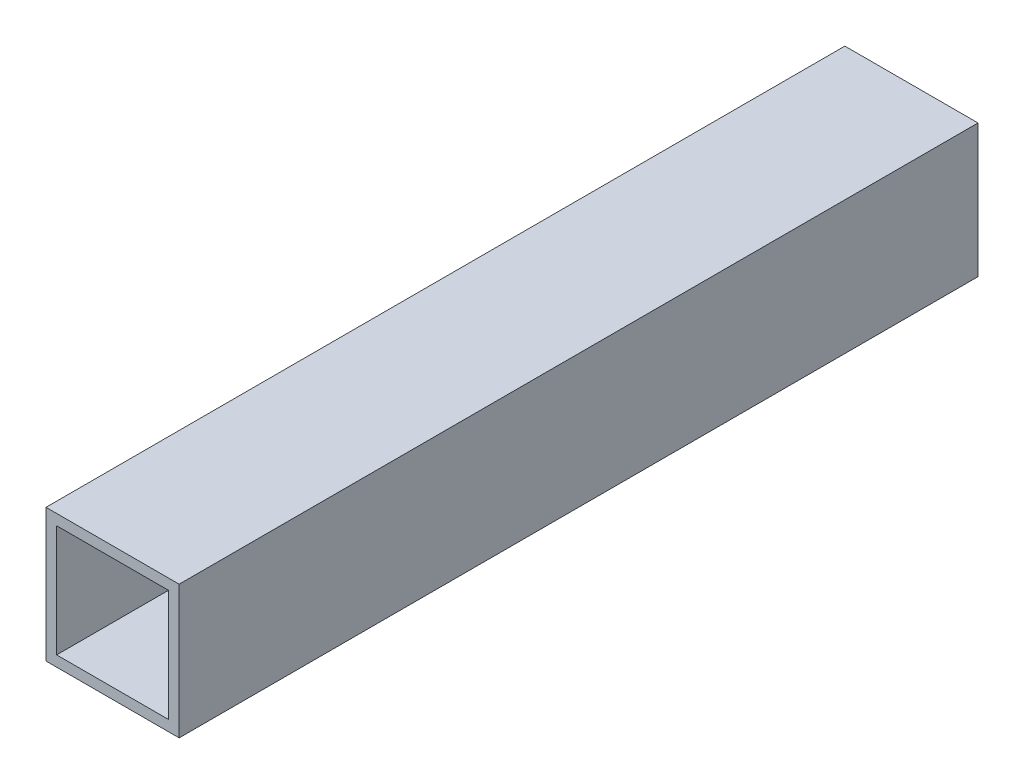
from build123d import *

# Parameters (mm, degrees)
SKIZZE1_W                       = 25
SKIZZE1_H                       = 25
SKIZZE1_W_2                     = 21
SKIZZE1_H_2                     = 21
AUFSATZ_LINEAR_AUSTRAGEN1_DEPTH = 150


with BuildPart() as part:
    # Skizze1 → Aufsatz-Linear austragen1 (new body)
    with BuildSketch(Plane.XY):
        Rectangle(SKIZZE1_W, SKIZZE1_H)
        Rectangle(SKIZZE1_W_2, SKIZZE1_H_2, mode=Mode.SUBTRACT)
    extrude(amount=AUFSATZ_LINEAR_AUSTRAGEN1_DEPTH)


solid = part.part
